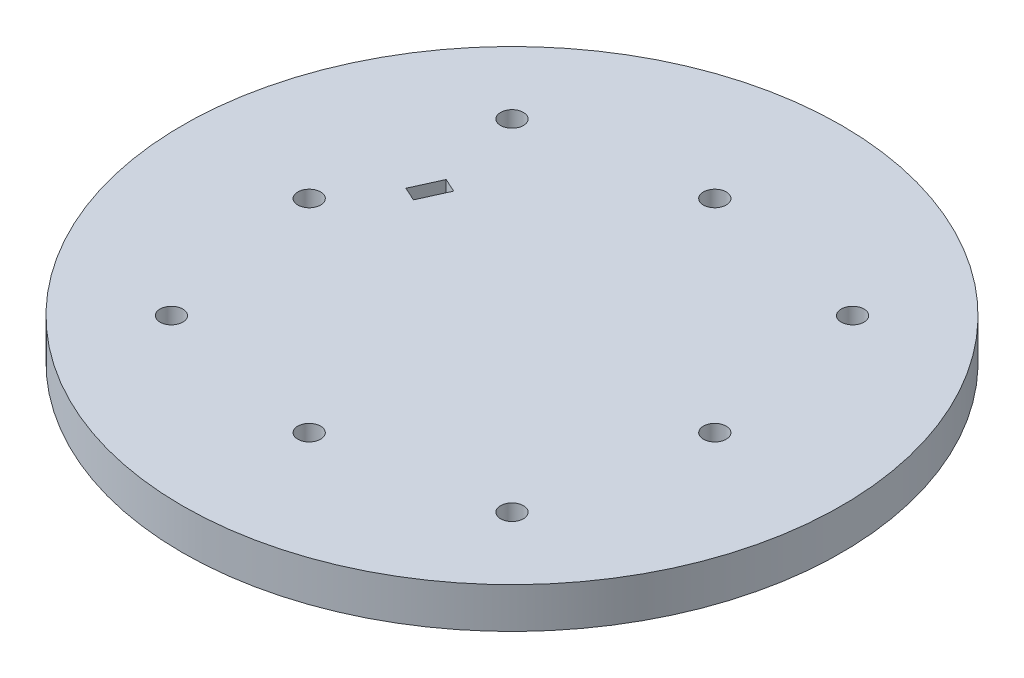
from build123d import *

# Parameters (mm, degrees)
SKETCH2_R           = 65
BOSS_EXTRUDE1_DEPTH = 8
SKETCH3_R           = 21
CUT_EXTRUDE1_DEPTH  = 4.5
SKETCH4_R           = 2.25
CUT_EXTRUDE2_DEPTH  = 93.271338995
SKETCH5_R           = 2.25
CUT_EXTRUDE3_DEPTH  = 93.271338995
PATH_TRENCH_DEPTH   = 2
CDG_R               = 1.7
CDG_CUT_DEPTH       = 6
CUT_EXTRUDE4_DEPTH  = 93.271338995


with BuildPart() as part:
    # Sketch2 → Boss-Extrude1 (new body)
    with BuildSketch(Plane(origin=(0, 0, 0), x_dir=(1, 0, 0), z_dir=(0, 1, 0))):
        with Locations(Location((0, 0, 0), (0, 0, 270))):
            Circle(SKETCH2_R)
    extrude(amount=BOSS_EXTRUDE1_DEPTH)

    # Sketch3 → Cut-Extrude1 (cut)
    with BuildSketch(Plane.XZ):
        with Locations(Location((0, 0, 0), (0, 0, 270))):
            Circle(SKETCH3_R)
    extrude(amount=-CUT_EXTRUDE1_DEPTH, mode=Mode.SUBTRACT)

    # Sketch4 → Cut-Extrude2 (cut, through all)
    with BuildSketch(Plane(origin=(0, 8, 0), x_dir=(1, 0, 0), z_dir=(0, 1, 0))):
        with Locations(Location((-40, 0, 0), (0, 0, 270))):
            Circle(SKETCH4_R)
        with Locations(Location((0, 40, 0), (0, 0, 270))):
            Circle(SKETCH4_R)
        with Locations(Location((40, 0, 0), (0, 0, 270))):
            Circle(SKETCH4_R)
        with Locations(Location((0, -40, 0), (0, 0, 270))):
            Circle(SKETCH4_R)
    extrude(amount=-CUT_EXTRUDE2_DEPTH, mode=Mode.SUBTRACT)

    # Sketch5 → Cut-Extrude3 (cut, through all)
    with BuildSketch(Plane(origin=(0, 8, 0), x_dir=(1, 0, 0), z_dir=(0, 1, 0))):
        with Locations(Location((-33.587572106, 33.587572106, 0), (0, 0, 270))):
            Circle(SKETCH5_R)
        with Locations(Location((33.587572106, 33.587572106, 0), (0, 0, 270))):
            Circle(SKETCH5_R)
        with Locations(Location((33.587572106, -33.587572106, 0), (0, 0, 270))):
            Circle(SKETCH5_R)
        with Locations(Location((-33.587572106, -33.587572106, 0), (0, 0, 270))):
            Circle(SKETCH5_R)
    extrude(amount=-CUT_EXTRUDE3_DEPTH, mode=Mode.SUBTRACT)

    # Sketch6 → path_trench (cut)
    with BuildSketch(Plane.XZ):
        Polygon((-29.480467623, -10.045000187), (-27.007252724, -15.511553769), (-16.07414556, -10.565123971), (-18.547360459, -5.098570389), align=None)
    extrude(amount=-PATH_TRENCH_DEPTH, mode=Mode.SUBTRACT)

    # CDG → CDG_CUT (cut)
    with BuildSketch(Plane.XZ):
        with Locations(Location((-27, 0, 0), (0, 0, 270))):
            Circle(CDG_R)
        with Locations(Location((13.5, 23.382685902, 0), (0, 0, 270))):
            Circle(CDG_R)
        with Locations(Location((13.5, -23.382685902, 0), (0, 0, 270))):
            Circle(CDG_R)
    extrude(amount=-CDG_CUT_DEPTH, mode=Mode.SUBTRACT)

    # Sketch7 → Cut-Extrude4 (cut, through all)
    with BuildSketch(Plane.XZ):
        Polygon((-29.480467623, -10.045000187), (-32.213744414, -11.281607636), (-29.740529515, -16.748161218), (-27.007252724, -15.511553769), align=None)
    extrude(amount=-CUT_EXTRUDE4_DEPTH, mode=Mode.SUBTRACT)


solid = part.part
